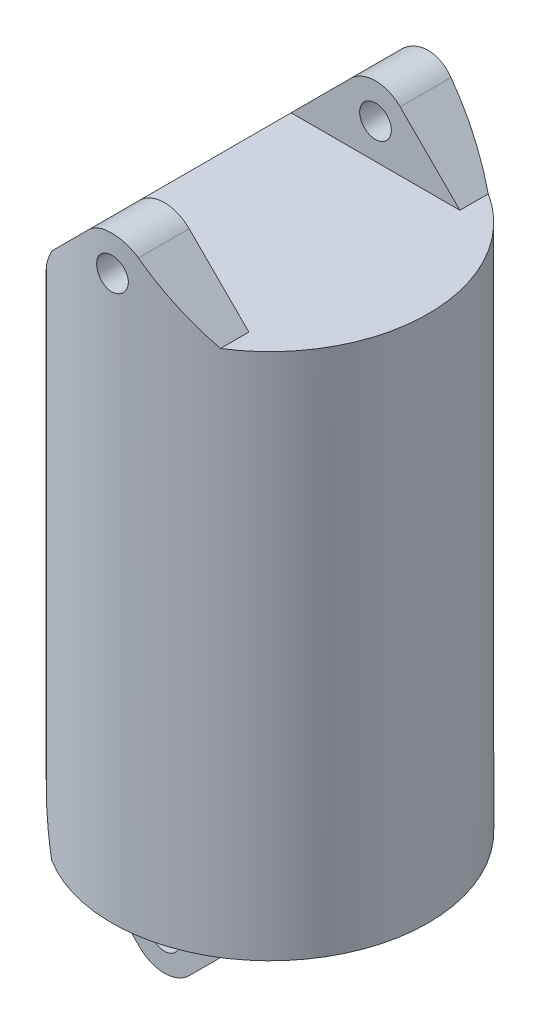
from build123d import *

# Parameters (mm, degrees)
CROQUIS1_R              = 15
SALIENTE_EXTRUIR1_DEPTH = 50
SALIENTE_EXTRUIR2_START = 5
SALIENTE_EXTRUIR2_DEPTH = 5
CROQUIS3_R              = 1.5
CORTAR_EXTRUIR1_DEPTH   = 5
CORTAR_EXTRUIR2_DEPTH   = 25
SALIENTE_EXTRUIR3_START = 10
CROQUIS5_R              = 1.5
SALIENTE_EXTRUIR3_DEPTH = 5
CROQUIS6_R              = 22.280416197
CROQUIS6_R_2            = 15
CORTAR_EXTRUIR3_DEPTH   = 20


with BuildPart() as part:
    # Croquis1 → Saliente-Extruir1 (new body)
    with BuildSketch(Plane(origin=(0, 0, 0), x_dir=(1, 0, 0), z_dir=(0, 1, 0))):
        with Locations(Location((0, 0, 0), (0, 0, 270))):
            Circle(CROQUIS1_R)
    extrude(amount=SALIENTE_EXTRUIR1_DEPTH)

    # Croquis2 → Saliente-Extruir2 (add)
    with BuildSketch(Plane.XY.offset(SALIENTE_EXTRUIR2_START)):
        with BuildLine():
            Line((-8, 0), (-2.343145751, -5.656854249))
            ThreePointArc((-2.343145751, -5.656854249), (0, -6.627416998), (2.343145751, -5.656854249))
            Line((2.343145751, -5.656854249), (8, 0))
            Line((8, 0), (-8, 0))
        make_face()
    saliente_extruir2 = extrude(amount=SALIENTE_EXTRUIR2_DEPTH)

    # Croquis3 → Cortar-Extruir1 (cut)
    with BuildSketch(Plane.XY.offset(10)):
        with Locations((0, -3.313708499)):
            Circle(CROQUIS3_R)
    cortar_extruir1 = extrude(amount=-CORTAR_EXTRUIR1_DEPTH, mode=Mode.SUBTRACT)

    # Simetría1: Saliente-Extruir2, Cortar-Extruir1 across plane
    add(saliente_extruir2.mirror(Plane.XY))
    add(cortar_extruir1.mirror(Plane.XY), mode=Mode.SUBTRACT)

    # Croquis4 → Cortar-Extruir2 (cut, symmetric)
    with BuildSketch(Plane.XY):
        Polygon((-8, 0), (-15, 0), (-15, 10), align=None)
    cortar_extruir2 = extrude(amount=CORTAR_EXTRUIR2_DEPTH, both=True, mode=Mode.SUBTRACT)

    # Simetría2: Cortar-Extruir2 across plane
    add(cortar_extruir2.mirror(Plane.ZX.offset(25)), mode=Mode.SUBTRACT)

    # Croquis5 → Saliente-Extruir3 (add)
    with BuildSketch(Plane.XY.offset(SALIENTE_EXTRUIR3_START)):
        with BuildLine():
            Line((-8, 50), (-2.343145751, 55.656854249))
            ThreePointArc((-2.343145751, 55.656854249), (0, 56.627416998), (2.343145751, 55.656854249))
            Line((2.343145751, 55.656854249), (8, 50))
            Line((8, 50), (-8, 50))
        make_face()
        with Locations((0, 53.313708499)):
            Circle(CROQUIS5_R, mode=Mode.SUBTRACT)
    saliente_extruir3 = extrude(amount=SALIENTE_EXTRUIR3_DEPTH)

    # Simetría3: Saliente-Extruir3 across plane
    add(saliente_extruir3.mirror(Plane.XY))

    # Croquis6 → Cortar-Extruir3 (cut)
    with BuildSketch(Plane(origin=(0, 50, 0), x_dir=(1, 0, 0), z_dir=(0, 1, 0))):
        Circle(CROQUIS6_R)
        with Locations(Location((0, 0, 0), (0, 0, 122.230952636))):
            Circle(CROQUIS6_R_2, mode=Mode.SUBTRACT)
    extrude(amount=CORTAR_EXTRUIR3_DEPTH, mode=Mode.SUBTRACT)


solid = part.part
